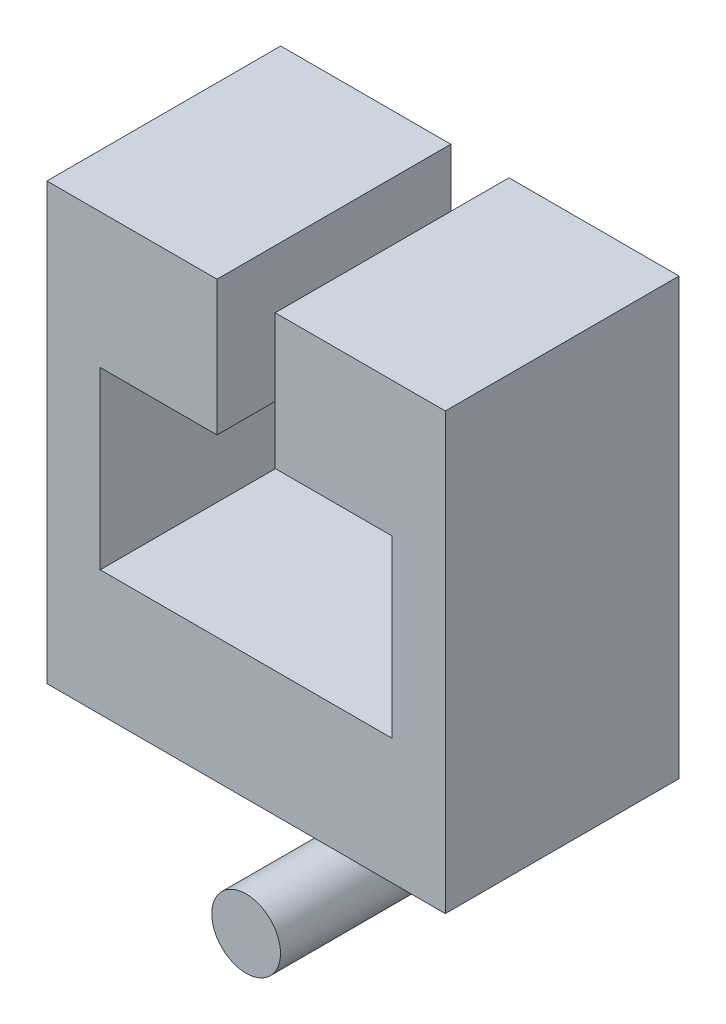
from build123d import *

# Parameters (mm, degrees)
SKETCH1_R             = 7.47268
BOSS_EXTRUDE1_DEPTH   = 50.8
SKETCH2_W             = 14.94536
SKETCH2_H             = 25.4
BOSS_EXTRUDE2_DEPTH   = 12.95146
SKETCH3_W             = 63.40856
SKETCH3_H             = 27.21864
BOSS_EXTRUDE3_DEPTH   = 50.8
SKETCH5_W             = 11.5824
SKETCH5_H             = 38.0746
BOSS_EXTRUDE4_DEPTH   = 50.8
BOSS_EXTRUDE4_2_DEPTH = 50.8
SKETCH7_W             = 11.5824
SKETCH7_H             = 27.21864
BOSS_EXTRUDE5_DEPTH   = 50.8
SKETCH8_W             = 25.37968
SKETCH8_H             = 29.31414
BOSS_EXTRUDE6_DEPTH   = 50.8
BOSS_EXTRUDE6_2_DEPTH = 50.8
SKETCH9_W             = 11.5824
SKETCH9_H             = 29.31414
BOSS_EXTRUDE7_DEPTH   = 50.8
BOSS_EXTRUDE8_DEPTH   = 2.54
BOSS_EXTRUDE9_DEPTH   = 2.54


with BuildPart() as part:
    # Sketch1 → Boss-Extrude1 (new body)
    with BuildSketch(Plane.XY):
        Circle(SKETCH1_R)
    extrude(amount=-BOSS_EXTRUDE1_DEPTH)

    # Sketch2 → Boss-Extrude2 (add)
    with BuildSketch(Plane(origin=(0, 0, -50.8), x_dir=(-1, 0, 0), z_dir=(0, 0, -1))):
        with Locations((0, 12.7)):
            Rectangle(SKETCH2_W, SKETCH2_H)
    extrude(amount=-BOSS_EXTRUDE2_DEPTH)

    # Sketch3 → Boss-Extrude3 (add)
    with BuildSketch(Plane(origin=(0, 0, -50.8), x_dir=(-1, 0, 0), z_dir=(0, 0, -1))):
        with Locations((0, 39.00932)):
            Rectangle(SKETCH3_W, SKETCH3_H)
    extrude(amount=-BOSS_EXTRUDE3_DEPTH)



with BuildPart() as body_2:
    # Sketch5 → Boss-Extrude4 (new body)
    with BuildSketch(Plane(origin=(0, 0, -50.8), x_dir=(-1, 0, 0), z_dir=(0, 0, -1))):
        with Locations((-37.49548, 71.65594)):
            Rectangle(SKETCH5_W, SKETCH5_H)
    extrude(amount=-BOSS_EXTRUDE4_DEPTH)


with BuildPart() as body_3:
    # Sketch5 → Boss-Extrude4 2 (new body)
    with BuildSketch(Plane(origin=(0, 0, -50.8), x_dir=(-1, 0, 0), z_dir=(0, 0, -1))):
        with Locations((37.49548, 71.65594)):
            Rectangle(SKETCH5_W, SKETCH5_H)
    extrude(amount=-BOSS_EXTRUDE4_2_DEPTH)


with BuildPart() as part_1:
    add(part.part)

    add(body_2.part)  # Boss-Extrude5 merges body 2

    add(body_3.part)  # Boss-Extrude5 merges body 3
    # Sketch7 → Boss-Extrude5 (add)
    with BuildSketch(Plane(origin=(0, 0, -50.8), x_dir=(-1, 0, 0), z_dir=(0, 0, -1))):
        with Locations((-37.49548, 39.00932)):
            Rectangle(SKETCH7_W, SKETCH7_H)
        with Locations((37.49548, 39.00932)):
            Rectangle(SKETCH7_W, SKETCH7_H)
    extrude(amount=-BOSS_EXTRUDE5_DEPTH)



with BuildPart() as body_2_2:
    # Sketch8 → Boss-Extrude6 (new body)
    with BuildSketch(Plane(origin=(0, 0, -50.8), x_dir=(-1, 0, 0), z_dir=(0, 0, -1))):
        with Locations((-19.01444, 105.35031)):
            Rectangle(SKETCH8_W, SKETCH8_H)
    extrude(amount=-BOSS_EXTRUDE6_DEPTH)


with BuildPart() as body_3_2:
    # Sketch8 → Boss-Extrude6 2 (new body)
    with BuildSketch(Plane(origin=(0, 0, -50.8), x_dir=(-1, 0, 0), z_dir=(0, 0, -1))):
        with Locations((19.01444, 105.35031)):
            Rectangle(SKETCH8_W, SKETCH8_H)
    extrude(amount=-BOSS_EXTRUDE6_2_DEPTH)


with BuildPart() as part_2:
    add(part_1.part)

    add(body_2_2.part)  # Boss-Extrude7 merges body 2 2

    add(body_3_2.part)  # Boss-Extrude7 merges body 3 2
    # Sketch9 → Boss-Extrude7 (add)
    with BuildSketch(Plane(origin=(0, 0, -50.8), x_dir=(-1, 0, 0), z_dir=(0, 0, -1))):
        with Locations((-37.49548, 105.35031)):
            Rectangle(SKETCH9_W, SKETCH9_H)
        with Locations((37.49548, 105.35031)):
            Rectangle(SKETCH9_W, SKETCH9_H)
    extrude(amount=-BOSS_EXTRUDE7_DEPTH)

    # Sketch10 → Boss-Extrude8 (add)
    with BuildSketch(Plane.ZY.offset(7.47268)):
        Polygon((-37.84854, 0), (-12.44854, 25.4), (-37.84854, 25.4), align=None)
    extrude(amount=-BOSS_EXTRUDE8_DEPTH)

    # Sketch11 → Boss-Extrude9 (add)
    with BuildSketch(Plane(origin=(7.47268, 0, 0), x_dir=(0, 0, -1), z_dir=(1, 0, 0))):
        Polygon((37.84854, 0), (12.44854, 25.4), (37.84854, 25.4), align=None)
    extrude(amount=-BOSS_EXTRUDE9_DEPTH)


solid = part_2.part
